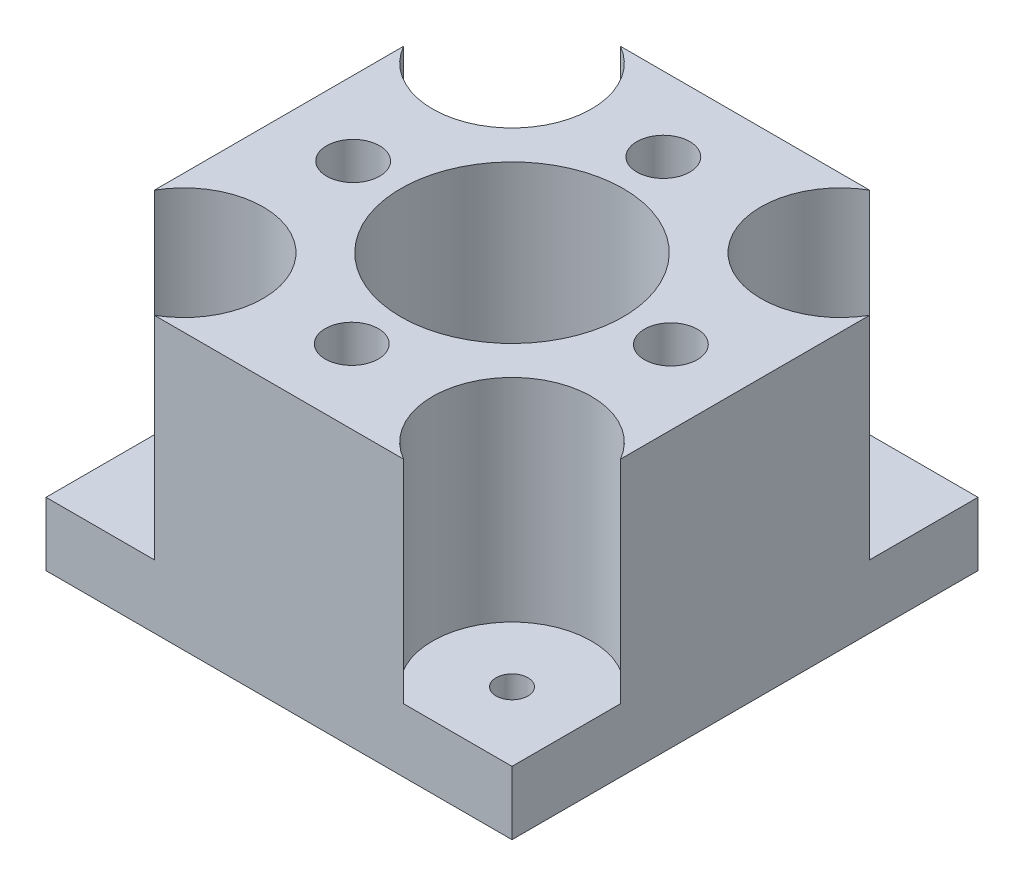
from build123d import *
from build123d.topology import SkipClean

# Parameters (mm, degrees)
SKETCH1_W           = 44
SKETCH1_H           = 44
SKETCH1_R           = 1.5
BOSS_EXTRUDE1_DEPTH = 3
SKETCH2_W           = 44
SKETCH2_H           = 44
SKETCH2_W_2         = 36
SKETCH2_H_2         = 36
BOSS_EXTRUDE2_DEPTH = 20
SKETCH3_R           = 10.5
CUT_EXTRUDE1_DEPTH  = 20
SKETCH4_W           = 44
SKETCH4_H           = 44
BOSS_EXTRUDE3_DEPTH = 3
SKETCH5_R           = 10.5
CUT_EXTRUDE2_DEPTH  = 20
SKETCH6_R           = 10.5
BOSS_EXTRUDE4_DEPTH = 23
SKETCH7_R           = 2.5
CUT_EXTRUDE3_DEPTH  = 33
BOSS_EXTRUDE5_START = 3
SKETCH8_R           = 1.5
BOSS_EXTRUDE5_DEPTH = 3


with BuildPart() as part:
    # Sketch1 → Boss-Extrude1 (new body)
    with BuildSketch(Plane(origin=(0, 0, 0), x_dir=(1, 0, 0), z_dir=(0, 1, 0))):
        Rectangle(SKETCH1_W, SKETCH1_H)
        with Locations(Location((-15.5, 15.5, 0), (0, 0, 270))):
            Circle(SKETCH1_R, mode=Mode.SUBTRACT)
        with Locations(Location((15.5, 15.5, 0), (0, 0, 270))):
            Circle(SKETCH1_R, mode=Mode.SUBTRACT)
        with Locations(Location((-15.5, -15.5, 0), (0, 0, 270))):
            Circle(SKETCH1_R, mode=Mode.SUBTRACT)
        with Locations(Location((15.5, -15.5, 0), (0, 0, 270))):
            Circle(SKETCH1_R, mode=Mode.SUBTRACT)
    extrude(amount=BOSS_EXTRUDE1_DEPTH)

    # Sketch2 → Boss-Extrude2 (add)
    with BuildSketch(Plane(origin=(0, 3, 0), x_dir=(1, 0, 0), z_dir=(0, 1, 0))):
        Rectangle(SKETCH2_W, SKETCH2_H)
        Rectangle(SKETCH2_W_2, SKETCH2_H_2, mode=Mode.SUBTRACT)
    extrude(amount=BOSS_EXTRUDE2_DEPTH)

    # Sketch3 → Cut-Extrude1 (cut)
    with BuildSketch(Plane(origin=(0, 3, 0), x_dir=(1, 0, 0), z_dir=(0, 1, 0))):
        with Locations(Location((0, 0, 0), (0, 0, 270))):
            Circle(SKETCH3_R)
    extrude(amount=-CUT_EXTRUDE1_DEPTH, mode=Mode.SUBTRACT)

    # Sketch4 → Boss-Extrude3 (add)
    with BuildSketch(Plane(origin=(0, 23, 0), x_dir=(1, 0, 0), z_dir=(0, 1, 0))):
        Rectangle(SKETCH4_W, SKETCH4_H)
    extrude(amount=BOSS_EXTRUDE3_DEPTH)

    # Sketch5 → Cut-Extrude2 (cut)
    with BuildSketch(Plane(origin=(0, 26, 0), x_dir=(1, 0, 0), z_dir=(0, 1, 0))):
        with Locations(Location((0, 0, 0), (0, 0, 270))):
            Circle(SKETCH5_R)
        with BuildLine():
            Line((-22, 22), (-22, 19.241657387))
            ThreePointArc((-22, 19.241657387), (-10.196699141, 10.196699141), (-19.241657387, 22))
            Line((-19.241657387, 22), (-22, 22))
        make_face()
        with BuildLine():
            Line((22, 22), (19.241657387, 22))
            ThreePointArc((19.241657387, 22), (10.196699141, 10.196699141), (22, 19.241657387))
            Line((22, 19.241657387), (22, 22))
        make_face()
        with BuildLine():
            Line((22, -22), (22, -19.241657387))
            ThreePointArc((22, -19.241657387), (10.196699141, -10.196699141), (19.241657387, -22))
            Line((19.241657387, -22), (22, -22))
        make_face()
        with BuildLine():
            Line((-22, -22), (-22, -19.241657387))
            ThreePointArc((-22, -19.241657387), (-10.196699141, -10.196699141), (-19.241657387, -22))
            Line((-19.241657387, -22), (-22, -22))
        make_face()
    extrude(amount=-CUT_EXTRUDE2_DEPTH, mode=Mode.SUBTRACT)

    # Sketch6 → Boss-Extrude4 (add)
    with SkipClean():  # the faces are left unmerged after this step: merging them gives an invalid solid
        with BuildSketch(Plane.XZ.offset(-23)):
            with BuildLine():
                Line((8.428932188, 18), (-8.428932188, 18))
                ThreePointArc((-8.428932188, 18), (-10.196699141, 10.196699141), (-18, 8.428932188))
                Line((-18, 8.428932188), (-18, -8.428932188))
                ThreePointArc((-18, -8.428932188), (-10.196699141, -10.196699141), (-8.428932188, -18))
                Line((-8.428932188, -18), (8.428932188, -18))
                ThreePointArc((8.428932188, -18), (10.196699141, -10.196699141), (18, -8.428932188))
                Line((18, -8.428932188), (18, 8.428932188))
                ThreePointArc((18, 8.428932188), (10.196699141, 10.196699141), (8.428932188, 18))
            make_face()
            with Locations(Location((0, 0, 0), (0, 0, 90))):
                Circle(SKETCH6_R, mode=Mode.SUBTRACT)
        extrude(amount=BOSS_EXTRUDE4_DEPTH)

    # Sketch7 → Cut-Extrude3 (cut)
    with SkipClean():  # the faces are left unmerged after this step: merging them gives an invalid solid
        with BuildSketch(Plane(origin=(0, 26, 0), x_dir=(1, 0, 0), z_dir=(0, 1, 0))):
            with Locations(Location((15, 0, 0), (0, 0, 270))):
                Circle(SKETCH7_R)
            with Locations(Location((-15, 0, 0), (0, 0, 270))):
                Circle(SKETCH7_R)
            with Locations(Location((-0.695414312, 14.983871293, 0), (0, 0, 270))):
                Circle(SKETCH7_R)
            with Locations(Location((-0.115302399, -15.016128707, 0), (0, 0, 270))):
                Circle(SKETCH7_R)
        extrude(amount=-CUT_EXTRUDE3_DEPTH, mode=Mode.SUBTRACT)

    # Sketch8 → Boss-Extrude5 (add)
    # profile 1 of 4: a face of its own
    with SkipClean():  # the faces are left unmerged after this step: merging them gives an invalid solid
        with BuildSketch(Plane(origin=(0, 3, 0), x_dir=(1, 0, 0), z_dir=(0, 1, 0)).offset(BOSS_EXTRUDE5_START)):
            with BuildLine():
                Line((8.428932188, -18), (18, -18))
                Line((18, -18), (18, -8.428932188))
                ThreePointArc((18, -8.428932188), (10.196699141, -10.196699141), (8.428932188, -18))
            make_face()
            with Locations(Location((15.5, -15.5, 0), (0, 0, 270))):
                Circle(SKETCH8_R, mode=Mode.SUBTRACT)
        # profile 2 of 4: a face of its own
        with BuildSketch(Plane(origin=(0, 3, 0), x_dir=(1, 0, 0), z_dir=(0, 1, 0)).offset(BOSS_EXTRUDE5_START)):
            with BuildLine():
                Line((18, 8.428932188), (18, 18))
                Line((18, 18), (8.428932188, 18))
                ThreePointArc((8.428932188, 18), (10.196699141, 10.196699141), (18, 8.428932188))
            make_face()
            with Locations(Location((15.5, 15.5, 0), (0, 0, 270))):
                Circle(SKETCH8_R, mode=Mode.SUBTRACT)
        # profile 3 of 4: a face of its own
        with BuildSketch(Plane(origin=(0, 3, 0), x_dir=(1, 0, 0), z_dir=(0, 1, 0)).offset(BOSS_EXTRUDE5_START)):
            with BuildLine():
                Line((-8.428932188, 18), (-18, 18))
                Line((-18, 18), (-18, 8.428932188))
                ThreePointArc((-18, 8.428932188), (-10.196699141, 10.196699141), (-8.428932188, 18))
            make_face()
            with Locations(Location((-15.5, 15.5, 0), (0, 0, 270))):
                Circle(SKETCH8_R, mode=Mode.SUBTRACT)
        # profile 4 of 4: a face of its own
        with BuildSketch(Plane(origin=(0, 3, 0), x_dir=(1, 0, 0), z_dir=(0, 1, 0)).offset(BOSS_EXTRUDE5_START)):
            with BuildLine():
                Line((-18, -8.428932188), (-18, -18))
                Line((-18, -18), (-8.428932188, -18))
                ThreePointArc((-8.428932188, -18), (-10.196699141, -10.196699141), (-18, -8.428932188))
            make_face()
            with Locations(Location((-15.5, -15.5, 0), (0, 0, 270))):
                Circle(SKETCH8_R, mode=Mode.SUBTRACT)
        extrude(amount=-BOSS_EXTRUDE5_DEPTH)


solid = part.part
